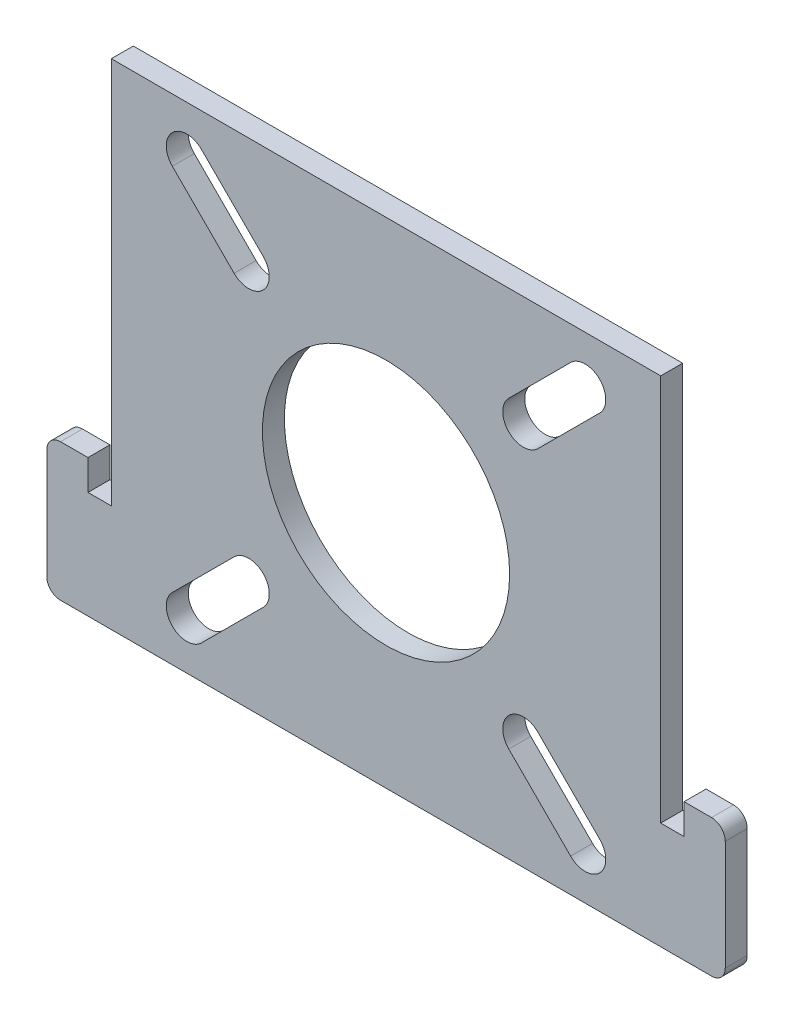
from build123d import *

# Parameters (mm, degrees)
SKETCH1_W           = 40
SKETCH1_H           = 36
BOSS_EXTRUDE1_DEPTH = 1.6
LENSE_HOLE_R        = 9
CUT_EXTRUDE1_DEPTH  = 27.954776942
CUT_EXTRUDE2_DEPTH  = 27.954776942
BOSS_EXTRUDE2_DEPTH = 1.6
FILLET1_R           = 1


with BuildPart() as part:
    # Sketch1 → Boss-Extrude1 (new body)
    with BuildSketch(Plane.XY):
        Rectangle(SKETCH1_W, SKETCH1_H)
    extrude(amount=BOSS_EXTRUDE1_DEPTH)

    # lense hole → Cut-Extrude1 (cut, through all)
    with BuildSketch(Plane.XY):
        Circle(LENSE_HOLE_R)
    extrude(amount=CUT_EXTRUDE1_DEPTH, mode=Mode.SUBTRACT)

    # Sketch4 → Cut-Extrude2 (cut, through all)
    with BuildSketch(Plane.XY):
        with BuildLine():
            Line((-13.439339828, 15.560660172), (-8.939339828, 11.060660172))
            ThreePointArc((-8.939339828, 11.060660172), (-8.939339828, 8.939339828), (-11.060660172, 8.939339828))
            Line((-11.060660172, 8.939339828), (-15.560660172, 13.439339828))
            ThreePointArc((-15.560660172, 13.439339828), (-15.560660172, 15.560660172), (-13.439339828, 15.560660172))
        make_face()
        with BuildLine():
            Line((8.939339828, 11.060660172), (13.439339828, 15.560660172))
            ThreePointArc((13.439339828, 15.560660172), (15.560660172, 15.560660172), (15.560660172, 13.439339828))
            Line((15.560660172, 13.439339828), (11.060660172, 8.939339828))
            ThreePointArc((11.060660172, 8.939339828), (8.939339828, 8.939339828), (8.939339828, 11.060660172))
        make_face()
        with BuildLine():
            Line((11.060660172, -8.939339828), (15.560660172, -13.439339828))
            ThreePointArc((15.560660172, -13.439339828), (15.560660172, -15.560660172), (13.439339828, -15.560660172))
            Line((13.439339828, -15.560660172), (8.939339828, -11.060660172))
            ThreePointArc((8.939339828, -11.060660172), (8.939339828, -8.939339828), (11.060660172, -8.939339828))
        make_face()
        with BuildLine():
            Line((-15.560660172, -13.439339828), (-11.060660172, -8.939339828))
            ThreePointArc((-11.060660172, -8.939339828), (-8.939339828, -8.939339828), (-8.939339828, -11.060660172))
            Line((-8.939339828, -11.060660172), (-13.439339828, -15.560660172))
            ThreePointArc((-13.439339828, -15.560660172), (-15.560660172, -15.560660172), (-15.560660172, -13.439339828))
        make_face()
    extrude(amount=CUT_EXTRUDE2_DEPTH, mode=Mode.SUBTRACT)

    # Sketch5 → Boss-Extrude2 (add)
    with BuildSketch(Plane.XY):
        Polygon((20, -18), (24.7, -18), (24.7, -8), (21.7, -8), (21.7, -10.2), (20, -10.2), align=None)
    boss_extrude2 = extrude(amount=BOSS_EXTRUDE2_DEPTH)

    # Mirror1: Boss-Extrude2 across plane
    add(boss_extrude2.mirror(Plane(origin=(0, 0, 0), x_dir=(0, 0, 1), z_dir=(1, 0, 0))))

    # Fillet1
    fillet1_edges = [part.edges().sort_by_distance(p)[0] for p in [
        (24.7, -18, 0.8),
        (24.7, -8, 0.8),
        (-24.7, -18, 0.8),
        (-24.7, -8, 0.8),
    ]]
    fillet(fillet1_edges, radius=FILLET1_R)


solid = part.part
